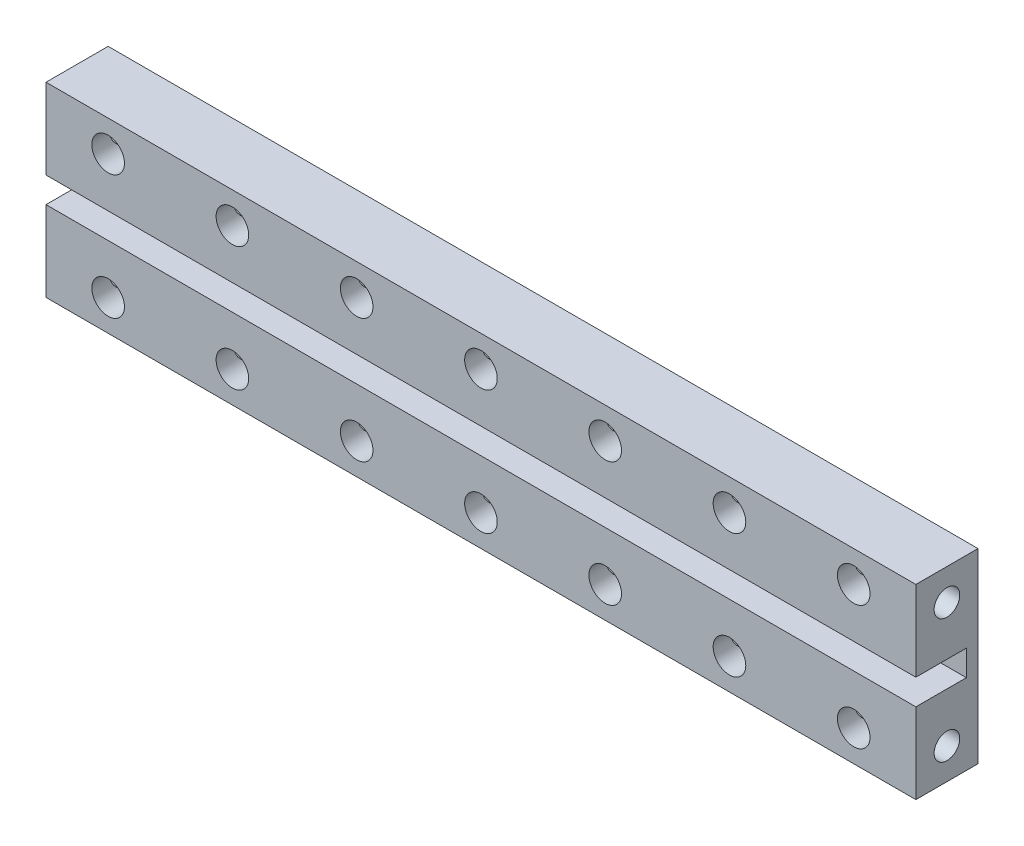
from build123d import *

# Parameters (mm, degrees)
BOSS_EXTRUDE1_DEPTH         = 112
TAP_DRILL_FOR_M4X0_7_TAP1_D = 3.3
F_4_2_4_2_DIAMETER_HOLE2_D  = 4.2
LPATTERN1_COUNT             = 7
LPATTERN1_PITCH             = 16


with BuildPart() as part:
    # Sketch2 → Boss-Extrude1 (new body)
    with BuildSketch(Plane(origin=(0, 0, 0), x_dir=(0, 0, -1), z_dir=(1, 0, 0))):
        Polygon((0, 12), (-8, 12), (-8, 1.65), (-1.5, 1.65), (-1.5, -1.65), (-8, -1.65), (-8, -12), (0, -12), align=None)
    extrude(amount=BOSS_EXTRUDE1_DEPTH)

    # Tap Drill for M4x0.7 Tap1 (through all)
    with Locations(Plane.ZY):
        with Locations((4, 8), (4, -8)):
            Hole(TAP_DRILL_FOR_M4X0_7_TAP1_D / 2)

    # Ø4.2 (4.2) Diameter Hole2 (through all)
    with Locations(Plane.XY.offset(8)):
        with Locations((8, 8), (8, -8)):
            f_4_2_4_2_diameter_hole2 = Hole(F_4_2_4_2_DIAMETER_HOLE2_D / 2)

    # LPattern1: Ø4.2 (4.2) Diameter Hole2 ×7
    with Locations(*[(i * LPATTERN1_PITCH, 0, 0) for i in range(1, LPATTERN1_COUNT)]):
        add(f_4_2_4_2_diameter_hole2, mode=Mode.SUBTRACT)


solid = part.part
